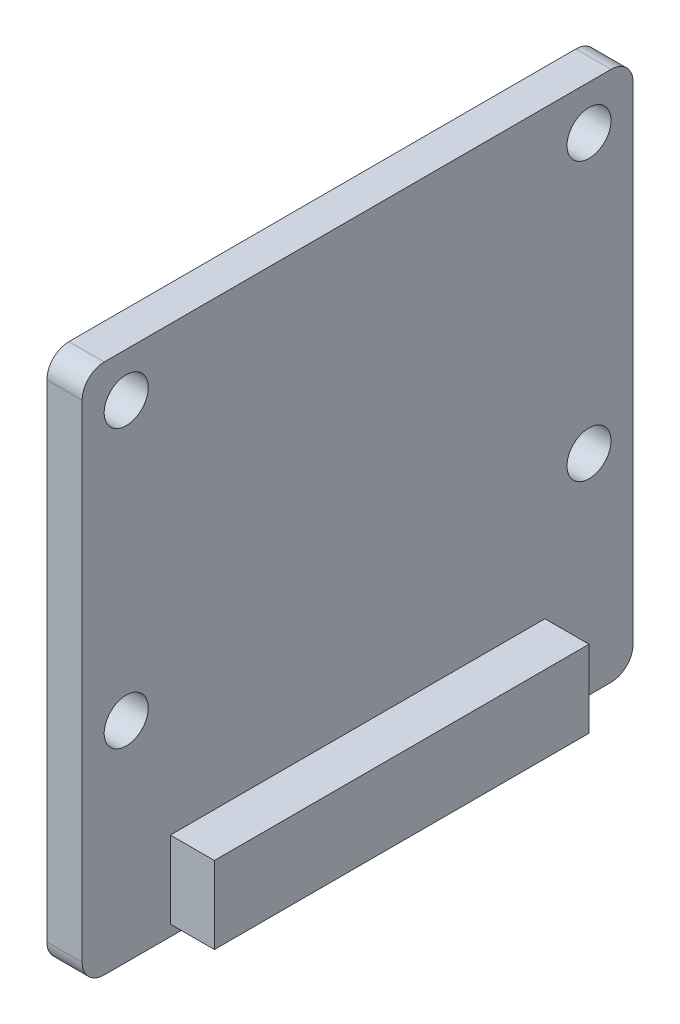
from build123d import *

# Parameters (mm, degrees)
IZIM1_W                     = 25
IZIM1_H                     = 24.09
Y_KSEKLIK_EKSTR_ZYON1_DEPTH = 1.6
IZIM2_W                     = 17
IZIM2_H                     = 3.5
Y_KSEKLIK_EKSTR_ZYON2_DEPTH = 2
RADYUS1_R                   = 1
IZIM5_R                     = 1
KES_EKSTR_ZYON1_DEPTH       = 10


with BuildPart() as part:
    # Çizim1 → Yükseklik-Ekstrüzyon1 (new body)
    with BuildSketch(Plane(origin=(1.6, 0, 0), x_dir=(0, 0, -1), z_dir=(1, 0, 0))):
        with Locations((0, -5.455)):
            Rectangle(IZIM1_W, IZIM1_H)
    extrude(amount=-Y_KSEKLIK_EKSTR_ZYON1_DEPTH)

    # Çizim2 → Yükseklik-Ekstrüzyon2 (add)
    with BuildSketch(Plane(origin=(1.6, 0, 0), x_dir=(0, 0, -1), z_dir=(1, 0, 0))):
        with Locations((0, -15.25)):
            Rectangle(IZIM2_W, IZIM2_H)
    extrude(amount=Y_KSEKLIK_EKSTR_ZYON2_DEPTH)

    # Radyus1
    radyus1_edges = [part.edges().sort_by_distance(p)[0] for p in [
        (0.8, 6.59, -12.5),
        (0.8, -17.5, -12.5),
        (0.8, -17.5, 12.5),
        (0.8, 6.59, 12.5),
    ]]
    fillet(radyus1_edges, radius=RADYUS1_R)

    # Çizim5 → Kes-Ekstrüzyon1 (cut)
    with BuildSketch(Plane(origin=(1.6, 0, 0), x_dir=(0, 0, -1), z_dir=(1, 0, 0))):
        with Locations((10.5, 4.59)):
            Circle(IZIM5_R)
        with Locations((-10.5, 4.59)):
            Circle(IZIM5_R)
        with Locations((-10.5, -8)):
            Circle(IZIM5_R)
        with Locations((10.5, -8)):
            Circle(IZIM5_R)
    extrude(amount=-KES_EKSTR_ZYON1_DEPTH, mode=Mode.SUBTRACT)


solid = part.part
